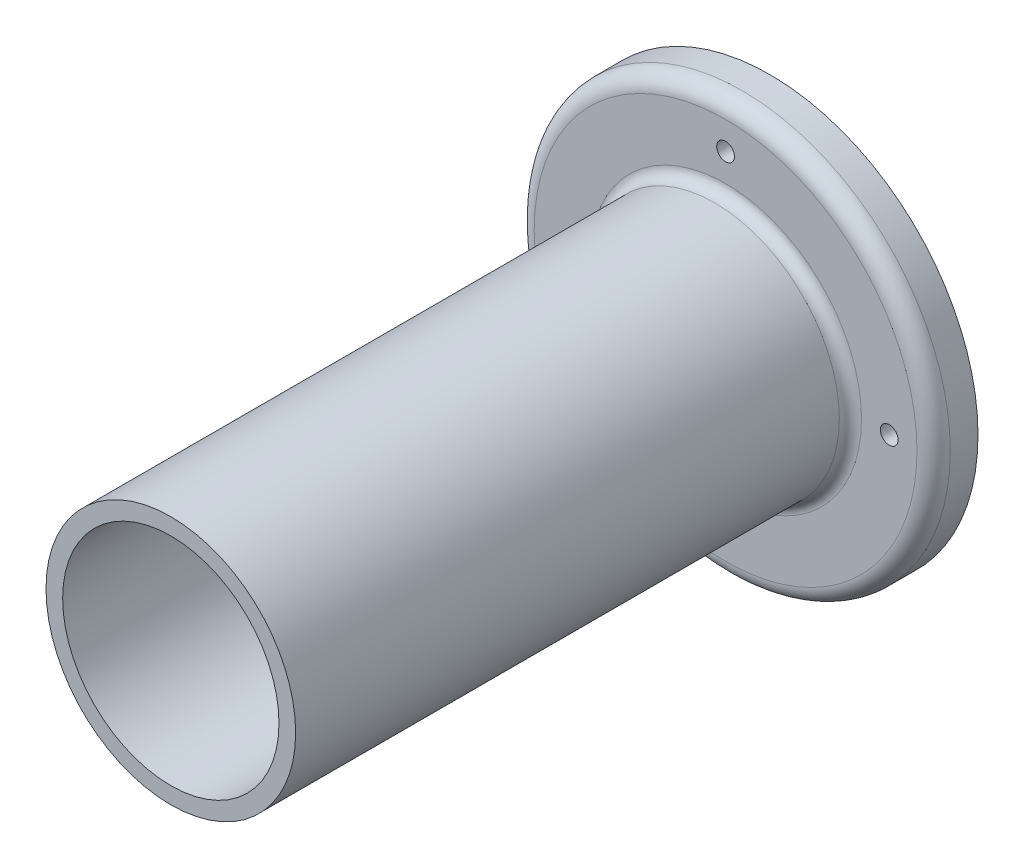
from build123d import *

# Parameters (mm, degrees)
SZKIC1_R                    = 37.5
SZKIC1_R_2                  = 1.6
DODANIE_WYCI_GNI_CIE1_DEPTH = 8
ZAOKR_GLENIE1_R             = 3
SZKIC2_R                    = 22.5
SZKIC2_R_2                  = 19.5
DODANIE_WYCI_GNI_CIE2_DEPTH = 100
ZAOKR_GLENIE2_R             = 2


with BuildPart() as part:
    # Szkic1 → Dodanie-wyciągnięcie1 (new body)
    with BuildSketch(Plane.XY):
        Circle(SZKIC1_R)
        with Locations((0, 29.5)):
            Circle(SZKIC1_R_2, mode=Mode.SUBTRACT)
        with Locations((29.5, 0)):
            Circle(SZKIC1_R_2, mode=Mode.SUBTRACT)
        with Locations((0, -29.5)):
            Circle(SZKIC1_R_2, mode=Mode.SUBTRACT)
        with Locations((-29.5, 0)):
            Circle(SZKIC1_R_2, mode=Mode.SUBTRACT)
    extrude(amount=DODANIE_WYCI_GNI_CIE1_DEPTH)

    # Zaokrąglenie1
    zaokr_glenie1_edges = [part.edges().sort_by_distance(p)[0] for p in [
        (-37.5, 0, 8),
    ]]
    fillet(zaokr_glenie1_edges, radius=ZAOKR_GLENIE1_R)

    # Szkic2 → Dodanie-wyciągnięcie2 (add)
    with BuildSketch(Plane.XY.offset(8)):
        Circle(SZKIC2_R)
        Circle(SZKIC2_R_2, mode=Mode.SUBTRACT)
    extrude(amount=DODANIE_WYCI_GNI_CIE2_DEPTH)

    # Zaokrąglenie2
    zaokr_glenie2_edges = [part.edges().sort_by_distance(p)[0] for p in [
        (-22.5, 0, 8),
    ]]
    fillet(zaokr_glenie2_edges, radius=ZAOKR_GLENIE2_R)


solid = part.part
